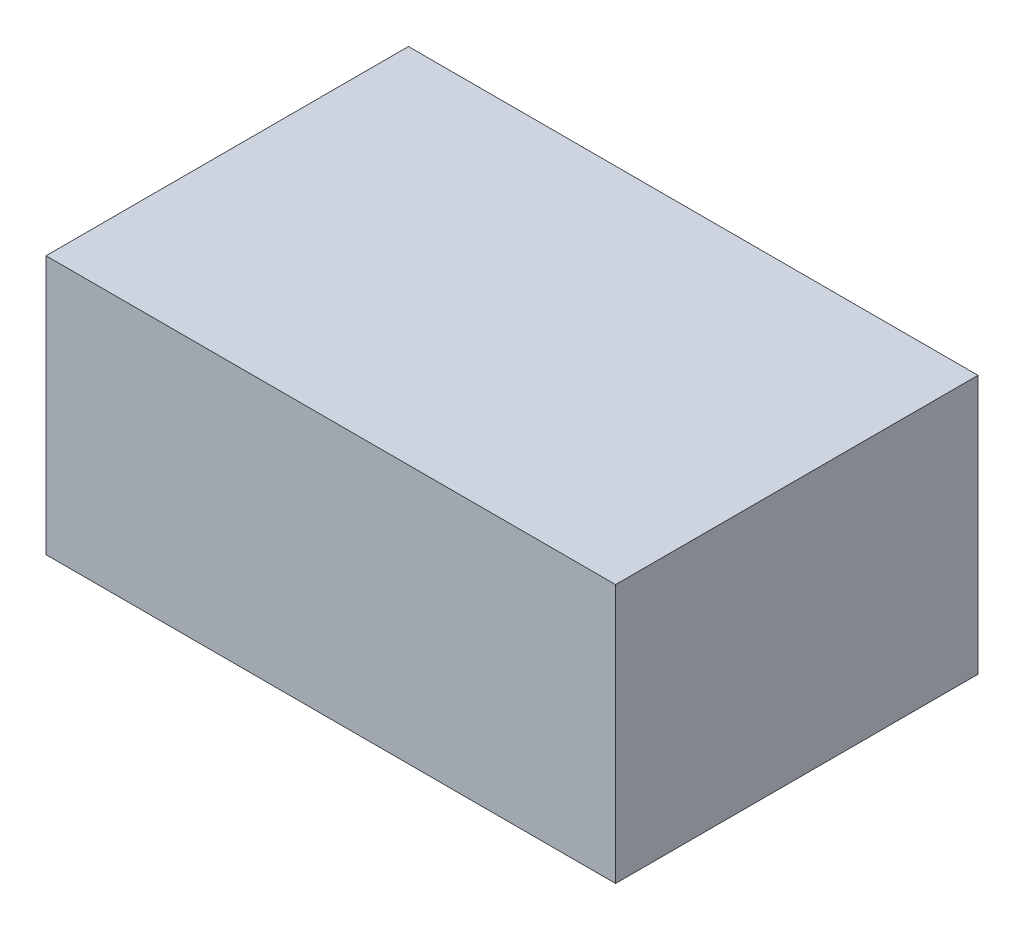
from build123d import *

# Parameters (mm, degrees)
SKETCH_1_W      = 55
SKETCH_1_H      = 25
EXTRUDE_1_DEPTH = 35


with BuildPart() as part:
    # 草图1 → 凸台-拉伸1 (new body)
    with BuildSketch(Plane.XY):
        Rectangle(SKETCH_1_W, SKETCH_1_H)
    extrude(amount=EXTRUDE_1_DEPTH)


solid = part.part
